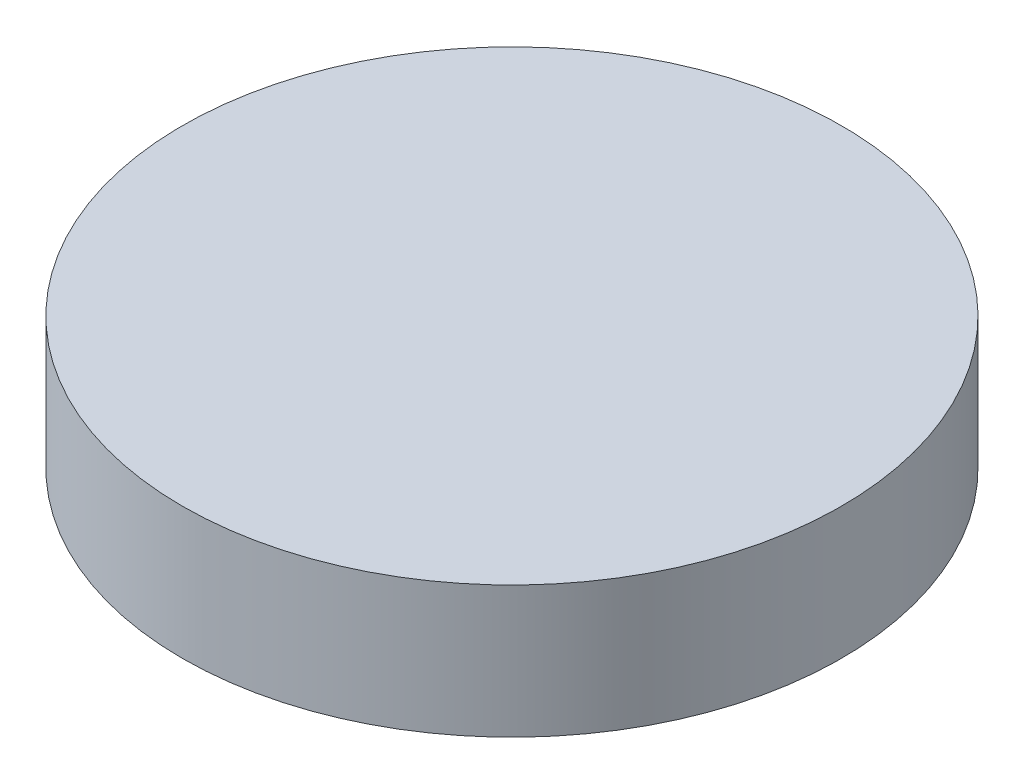
from build123d import *

# Parameters (mm, degrees)
SKETCH2_R           = 50
BOSS_EXTRUDE1_DEPTH = 20


with BuildPart() as part:
    # Sketch2 → Boss-Extrude1 (new body)
    with BuildSketch(Plane(origin=(0, 0, 0), x_dir=(1, 0, 0), z_dir=(0, 1, 0))):
        with Locations(Location((0, 0, 0), (0, 0, 270))):
            Circle(SKETCH2_R)
    extrude(amount=BOSS_EXTRUDE1_DEPTH)


solid = part.part
